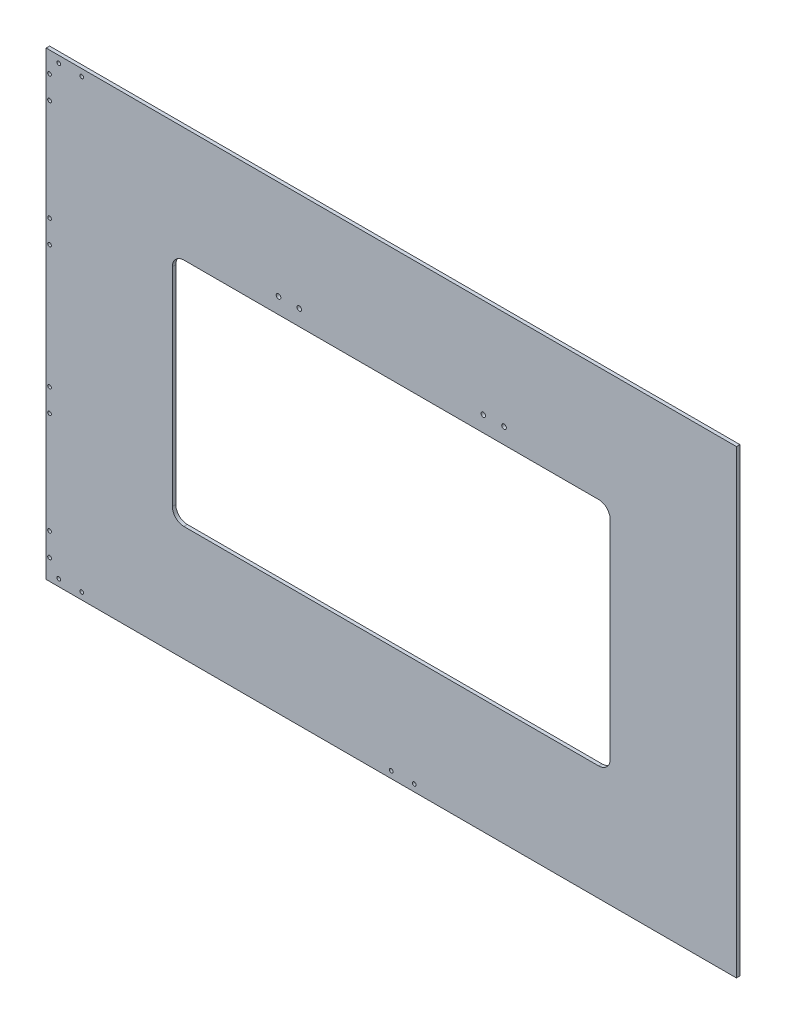
from build123d import *

# Parameters (mm, degrees)
SKETCH_1_W          = 600
SKETCH_1_H          = 400
EXTRUDE_1_DEPTH     = 3
SKETCH_2_R          = 1.6
CUT_EXTRUDE_1_DEPTH = 361.567608085
SKETCH_4_R          = 1.6
CUT_EXTRUDE_2_DEPTH = 361.567608085
SKETCH_6_R          = 1.6
CUT_EXTRUDE_3_DEPTH = 361.567608085
SKETCH_7_W          = 380.5
SKETCH_7_H          = 200.5
CUT_EXTRUDE_4_DEPTH = 361.567608085
SKETCH_8_R          = 1.575
CUT_EXTRUDE_5_DEPTH = 361.567608085
SKETCH_9_R          = 2
CUT_EXTRUDE_6_DEPTH = 361.567608085
FILLET_1_R          = 10


with BuildPart() as part:
    # 草图1 → 凸台-拉伸1 (new body)
    with BuildSketch(Plane.XY):
        Rectangle(SKETCH_1_W, SKETCH_1_H)
    extrude(amount=EXTRUDE_1_DEPTH)

    # 草图2 → 切除-拉伸1 (cut, through all)
    with BuildSketch(Plane.XY.offset(3)):
        with Locations((-297, 162)):
            Circle(SKETCH_2_R)
        with Locations((-297, 182)):
            Circle(SKETCH_2_R)
        with Locations((-289, 194)):
            Circle(SKETCH_2_R)
        with Locations((-269, 194)):
            Circle(SKETCH_2_R)
    extrude(amount=-CUT_EXTRUDE_1_DEPTH, mode=Mode.SUBTRACT)

    # 草图4 → 切除-拉伸2 (cut, through all)
    with BuildSketch(Plane.XY.offset(3)):
        with Locations((-297, -162)):
            Circle(SKETCH_4_R)
        with Locations((-297, -182)):
            Circle(SKETCH_4_R)
        with Locations((-289, -194)):
            Circle(SKETCH_4_R)
        with Locations((-269, -194)):
            Circle(SKETCH_4_R)
    extrude(amount=-CUT_EXTRUDE_2_DEPTH, mode=Mode.SUBTRACT)

    # 草图6 → 切除-拉伸3 (cut, through all)
    with BuildSketch(Plane(origin=(0, 0, 0), x_dir=(-1, 0, 0), z_dir=(0, 0, -1))):
        with Locations((0, -194)):
            Circle(SKETCH_6_R)
        with Locations((-20, -194)):
            Circle(SKETCH_6_R)
    extrude(amount=-CUT_EXTRUDE_3_DEPTH, mode=Mode.SUBTRACT)

    # 草图7 → 切除-拉伸4 (cut, through all)
    with BuildSketch(Plane.XY.offset(3)):
        Rectangle(SKETCH_7_W, SKETCH_7_H)
    extrude(amount=-CUT_EXTRUDE_4_DEPTH, mode=Mode.SUBTRACT)

    # 草图8 → 切除-拉伸5 (cut, through all)
    with BuildSketch(Plane.XY.offset(3)):
        with Locations((-297, 73.5)):
            Circle(SKETCH_8_R)
        with Locations((-297, 53.5)):
            Circle(SKETCH_8_R)
        with Locations((-297, -53.5)):
            Circle(SKETCH_8_R)
        with Locations((-297, -73.5)):
            Circle(SKETCH_8_R)
    extrude(amount=-CUT_EXTRUDE_5_DEPTH, mode=Mode.SUBTRACT)

    # 草图9 → 切除-拉伸6 (cut, through all)
    with BuildSketch(Plane.XY.offset(3)):
        with Locations((-98, 114)):
            Circle(SKETCH_9_R)
        with Locations((-80, 114)):
            Circle(SKETCH_9_R)
        with Locations(Location((80, 114, 0), (0, 0, 180))):
            Circle(SKETCH_9_R)
        with Locations(Location((98, 114, 0), (0, 0, 180))):
            Circle(SKETCH_9_R)
    extrude(amount=-CUT_EXTRUDE_6_DEPTH, mode=Mode.SUBTRACT)

    # 圆角1
    fillet_1_edges = [part.edges().sort_by_distance(p)[0] for p in [
        (190.25, 100.25, 1.5),
        (190.25, -100.25, 1.5),
        (-190.25, -100.25, 1.5),
        (-190.25, 100.25, 1.5),
    ]]
    fillet(fillet_1_edges, radius=FILLET_1_R)


solid = part.part
